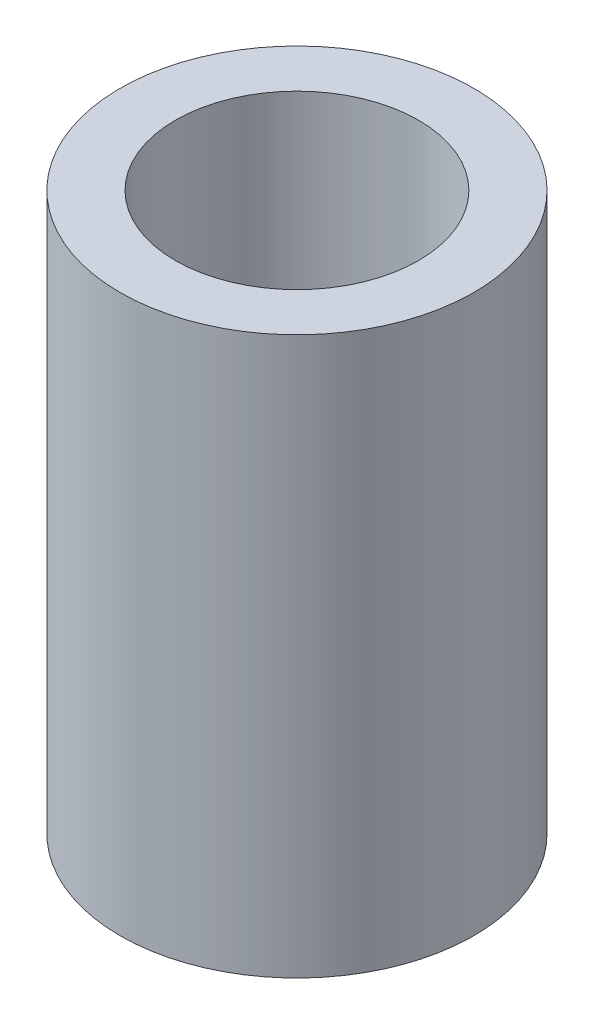
from build123d import *

# Parameters (mm, degrees)
SKETCH1_R           = 4
SKETCH1_R_2         = 2.75
BOSS_EXTRUDE1_DEPTH = 12.6


with BuildPart() as part:
    # Sketch1 → Boss-Extrude1 (new body)
    with BuildSketch(Plane(origin=(0, 0, 0), x_dir=(1, 0, 0), z_dir=(0, 1, 0))):
        with Locations(Location((0, 0, 0), (0, 0, 270))):
            Circle(SKETCH1_R)
        with Locations(Location((0, 0, 0), (0, 0, 270))):
            Circle(SKETCH1_R_2, mode=Mode.SUBTRACT)
    extrude(amount=BOSS_EXTRUDE1_DEPTH)


solid = part.part
